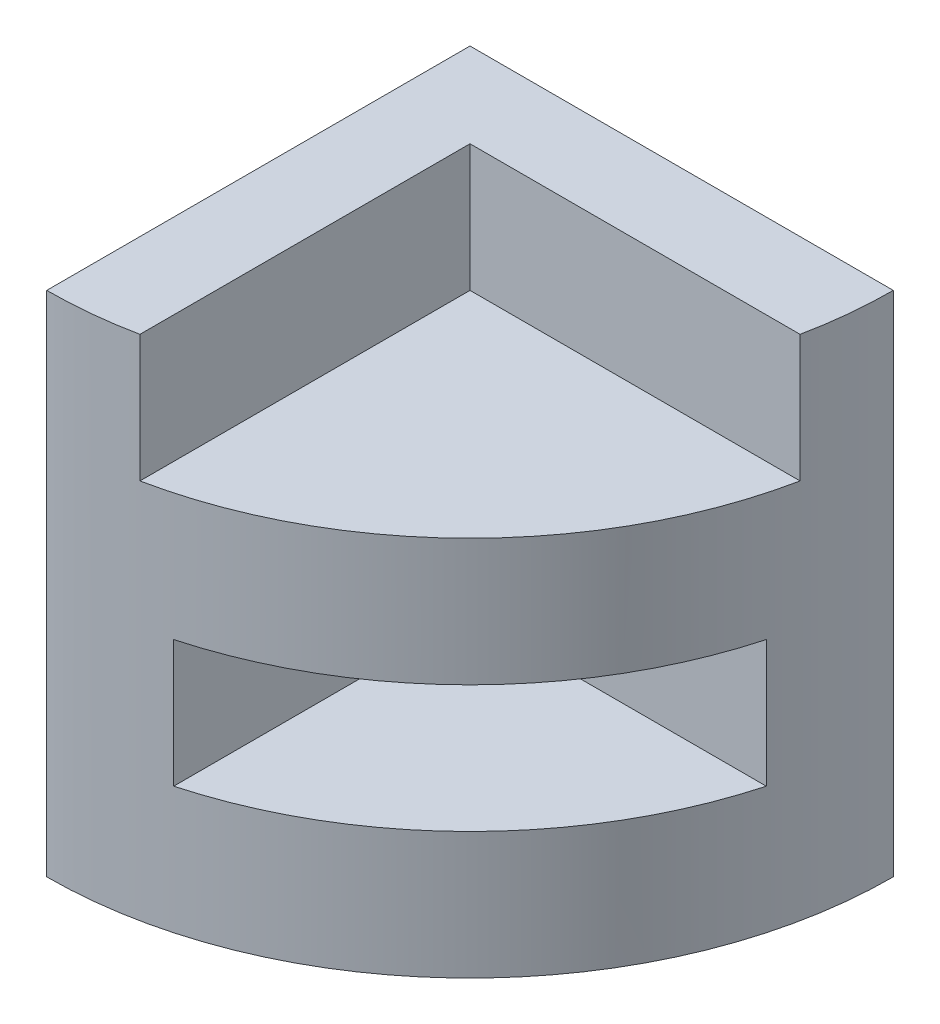
from build123d import *

# Parameters (mm, degrees)
BOSS_EXTRUDE1_DEPTH = 4.5
CUT_EXTRUDE1_START  = -3
CUT_EXTRUDE1_DEPTH  = 1.5
BOSS_EXTRUDE2_DEPTH = 1.5


with BuildPart() as part:
    # Sketch1 → Boss-Extrude1 (new body)
    with BuildSketch(Plane(origin=(0, 0, 0), x_dir=(1, 0, 0), z_dir=(0, 1, 0))):
        with BuildLine():
            Line((0, 0), (5, 0))
            ThreePointArc((5, 0), (3.535533906, -3.535533906), (0, -5))
            Line((0, -5), (0, 0))
        make_face()
    extrude(amount=BOSS_EXTRUDE1_DEPTH)

    # Sketch2 → Cut-Extrude1 (cut)
    with BuildSketch(Plane(origin=(0, 4.5, 0), x_dir=(1, 0, 0), z_dir=(0, 1, 0)).offset(CUT_EXTRUDE1_START)):
        with BuildLine():
            Line((4.822051432, -1.322051432), (1.322051432, -1.322051432))
            Line((1.322051432, -1.322051432), (1.322051432, -4.822051432))
            ThreePointArc((1.322051432, -4.822051432), (3.535533906, -3.535533906), (4.822051432, -1.322051432))
        make_face()
    extrude(amount=CUT_EXTRUDE1_DEPTH, mode=Mode.SUBTRACT)

    # Sketch3 → Boss-Extrude2 (add)
    with BuildSketch(Plane(origin=(0, 4.5, 0), x_dir=(1, 0, 0), z_dir=(0, 1, 0))):
        with BuildLine():
            Line((4.898979486, -1), (1, -1))
            Line((1, -1), (1, -4.898979486))
            ThreePointArc((1, -4.898979486), (0.50254481, -4.974680765), (0, -5))
            Line((0, -5), (0, 0))
            Line((0, 0), (5, 0))
            ThreePointArc((5, 0), (4.974680765, -0.50254481), (4.898979486, -1))
        make_face()
    extrude(amount=BOSS_EXTRUDE2_DEPTH)


solid = part.part
